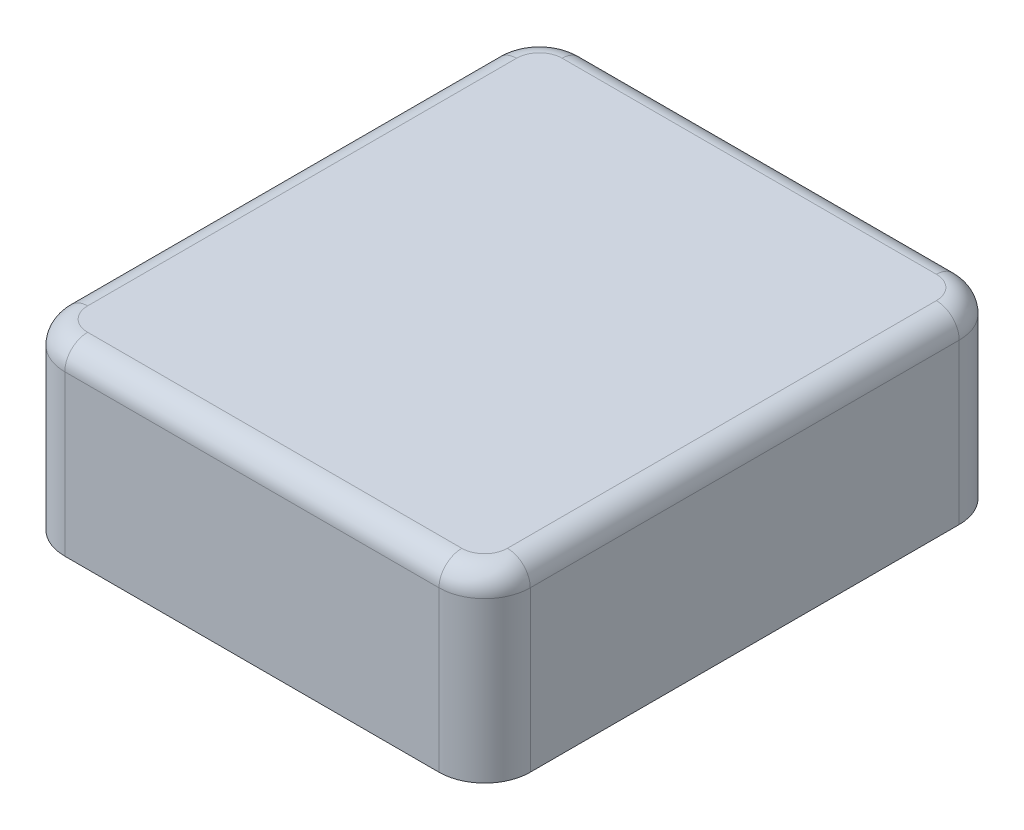
from build123d import *

# Parameters (mm, degrees)
SKETCH1_W                       = 64.77
SKETCH1_H                       = 25.4
BOSS_EXTRUDE1_DEPTH             = 36.195
FILLET1_R                       = 6.35
FILLET2_R                       = 3.175
SHELL2_T                        = 1.524
EXTRUDE_THIN1_REACH             = 52.201
SKETCH2_W                       = 61.722
SKETCH2_H                       = 1.524
EXTRUDE_THIN1_DIRECTION_2_REACH = 52.201
CUT_EXTRUDE2_REACH              = 82.314
SKETCH4_R                       = 2.159


with BuildPart() as part:
    # Sketch1 → Boss-Extrude1 (new, symmetric)
    with BuildSketch(Plane.XY):
        Rectangle(SKETCH1_W, SKETCH1_H)
    extrude(amount=BOSS_EXTRUDE1_DEPTH, both=True)

    # Fillet1
    fillet1_edges = [part.edges().sort_by_distance(p)[0] for p in [
        (32.385, 0, -36.195),
        (-32.385, 0, -36.195),
        (32.385, 0, 36.195),
        (-32.385, 0, 36.195),
    ]]
    fillet(fillet1_edges, radius=FILLET1_R)

    # Fillet2
    fillet2_edges = [part.edges().sort_by_distance(p)[0] for p in [
        (-32.385, 12.7, 0),
        (0, 12.7, -36.195),
        (0, 12.7, 36.195),
        (32.385, 12.7, 0),
        (-30.525128061, 12.7, 34.335128061),
        (30.525128061, 12.7, 34.335128061),
        (30.525128061, 12.7, -34.335128061),
        (-30.525128061, 12.7, -34.335128061),
    ]]
    fillet(fillet2_edges, radius=FILLET2_R)

    # Shell2 (no face opened: a closed hollow body)
    add(offset(amount=-SHELL2_T, mode=Mode.PRIVATE), mode=Mode.SUBTRACT)

    # Sketch2 → Extrude-Thin1 (add, up to next)
    with BuildSketch(Plane.XY, mode=Mode.PRIVATE) as extrude_thin1_sk1:
        with Locations((0, -4.423126072)):
            Rectangle(SKETCH2_W, SKETCH2_H)
    extrude_thin1_tool1 = extrude(extrude_thin1_sk1.sketch, amount=EXTRUDE_THIN1_REACH, mode=Mode.PRIVATE) - part.part
    add(extrude_thin1_tool1.solids().sort_by_distance((0, -4.423126, 0))[0])

    # Sketch2 → Extrude-Thin1 direction 2 (add, up to next)
    with BuildSketch(Plane.XY, mode=Mode.PRIVATE) as extrude_thin1_direction_2_sk1:
        with Locations((0, -4.423126072)):
            Rectangle(SKETCH2_W, SKETCH2_H)
    extrude_thin1_direction_2_tool1 = extrude(extrude_thin1_direction_2_sk1.sketch, amount=-EXTRUDE_THIN1_DIRECTION_2_REACH, mode=Mode.PRIVATE) - part.part
    add(extrude_thin1_direction_2_tool1.solids().sort_by_distance((0, -4.423126, 0))[0])

    # Sketch4 → Cut-Extrude2 (cut, up to next)
    with BuildSketch(Plane.XY.offset(-36.195), mode=Mode.PRIVATE) as cut_extrude2_sk1:
        with Locations((12.001819726, -7.705800204)):
            Circle(SKETCH4_R)
    cut_extrude2_tool1 = extrude(cut_extrude2_sk1.sketch, amount=CUT_EXTRUDE2_REACH, mode=Mode.PRIVATE) & part.part
    add(cut_extrude2_tool1.solids().sort_by_distance((12.00182, -7.7058, -36.195))[0], mode=Mode.SUBTRACT)


solid = part.part
